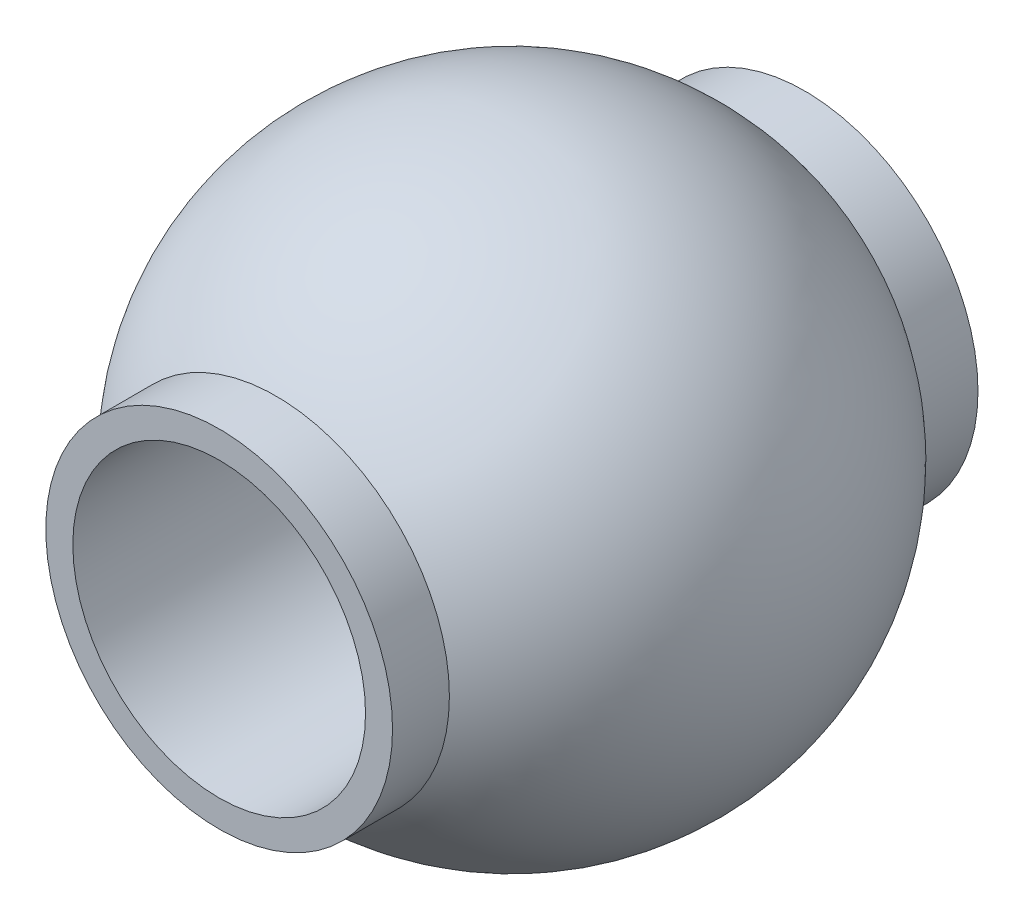
from build123d import *

# Parameters (mm, degrees)
ENL_V_MAT_EXTRU_1_DEPTH      = 6.196152423
ENL_V_MAT_EXTRU_1_DEPTH_BACK = 6.196152423
ESQUISSE2_R                  = 1.5
BOSS_EXTRU_1_DEPTH           = 3
BOSS_EXTRU_1_DEPTH_BACK      = 3
ESQUISSE3_R                  = 1.776748734
ESQUISSE3_R_2                = 1.5


with BuildPart() as part:
    # Esquisse1 → Révolution1 (revolve)
    with BuildSketch(Plane.XY):
        with BuildLine():
            Line((0, -3), (0, 3))
            ThreePointArc((0, 3), (-3, 0), (0, -3))
        make_face()
    revolve(axis=Axis((0, 4.208011384, 0), (0, -1, 0)))

    # Esquisse2 → Enlèv. mat.-Extru.1 (cut, two sides: drawn at the far end of the back side and taken through both)
    with BuildSketch(Plane.XY.offset(-ENL_V_MAT_EXTRU_1_DEPTH_BACK)):
        Circle(ESQUISSE2_R)
    extrude(amount=ENL_V_MAT_EXTRU_1_DEPTH + ENL_V_MAT_EXTRU_1_DEPTH_BACK, mode=Mode.SUBTRACT)

    # Esquisse3 → Boss.-Extru.1 (add, two sides: drawn at the far end of the back side and taken through both)
    with BuildSketch(Plane.XY.offset(-BOSS_EXTRU_1_DEPTH_BACK)):
        Circle(ESQUISSE3_R)
        Circle(ESQUISSE3_R_2, mode=Mode.SUBTRACT)
    extrude(amount=BOSS_EXTRU_1_DEPTH + BOSS_EXTRU_1_DEPTH_BACK)


solid = part.part
